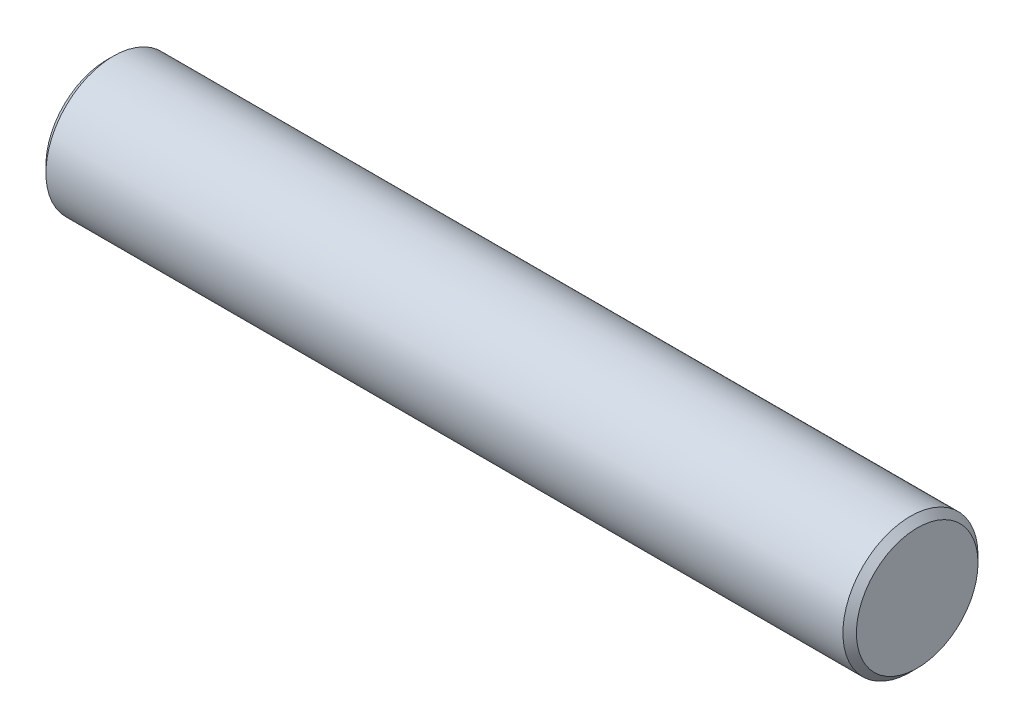
from build123d import *

# Parameters (mm, degrees)
SKETCH2_R           = 1
BOSS_EXTRUDE1_DEPTH = 6
CHAMFER1_SIZE       = 0.1


with BuildPart() as part:
    # Sketch2 → Boss-Extrude1 (new, symmetric)
    with BuildSketch(Plane(origin=(0, 0, 0), x_dir=(0, 0, -1), z_dir=(1, 0, 0))):
        Circle(SKETCH2_R)
    extrude(amount=BOSS_EXTRUDE1_DEPTH, both=True)

    # Chamfer1
    chamfer1_edges = [part.edges().sort_by_distance(p)[0] for p in [
        (-6, 0, 1),
        (6, 0, 1),
    ]]
    chamfer(chamfer1_edges, length=CHAMFER1_SIZE)


solid = part.part
